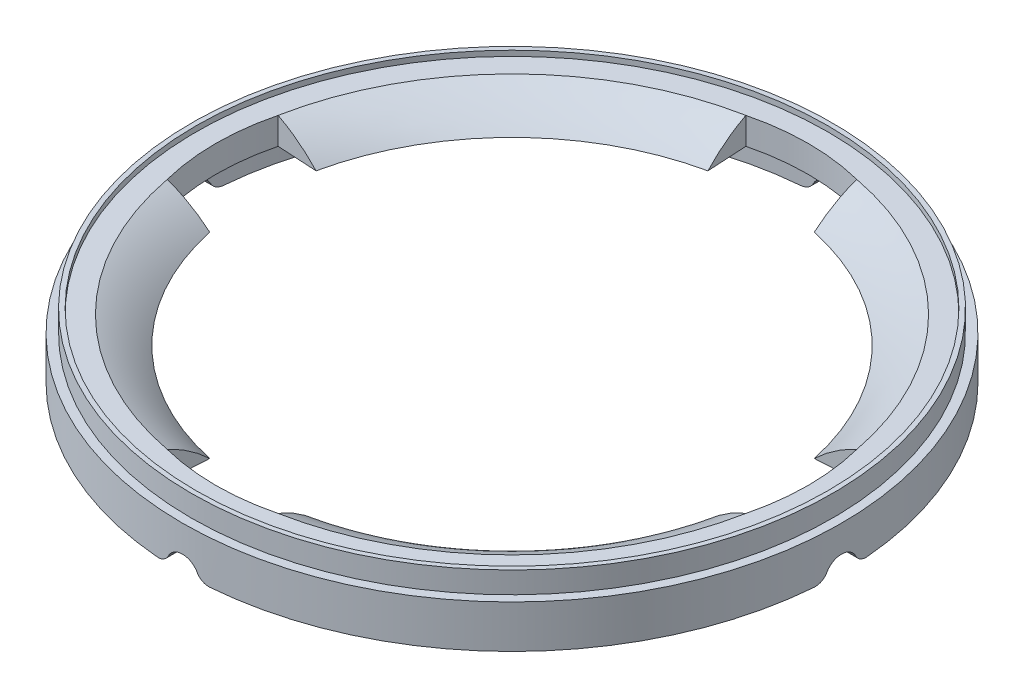
from build123d import *

# Parameters (mm, degrees)
SKETCH3_R                = 61.468
SKETCH3_R_2              = 58.95025584
BOSS_EXTRUDE1_DEPTH      = 8
SKETCH7_R                = 59.82025584
SKETCH7_R_2              = 58.95025584
BOSS_EXTRUDE2_DEPTH      = 4
CUT_EXTRUDE1_DEPTH       = 88.753233832
FILLET1_R                = 2.54
CIRPATTERN1_COUNT        = 4
FILLET1_OF_CIRPATTERN1_R = 2.54
CUT_EXTRUDE4_DEPTH       = 88.753233984
CIRPATTERN3_COUNT        = 4


with BuildPart() as part:
    # Sketch3 → Boss-Extrude1 (new body)
    with BuildSketch(Plane(origin=(0, 0, 0), x_dir=(1, 0, 0), z_dir=(0, 1, 0))):
        with Locations(Location((0, 0, 0), (0, 0, 270))):
            Circle(SKETCH3_R)
        with Locations(Location((0, 0, 0), (0, 0, 270))):
            Circle(SKETCH3_R_2, mode=Mode.SUBTRACT)
    extrude(amount=BOSS_EXTRUDE1_DEPTH)

    # Sketch7 → Boss-Extrude2 (add)
    with BuildSketch(Plane(origin=(0, 8, 0), x_dir=(1, 0, 0), z_dir=(0, 1, 0))):
        with Locations(Location((0, 0, 0), (0, 0, 270))):
            Circle(SKETCH7_R)
        with Locations(Location((0, 0, 0), (0, 0, 270))):
            Circle(SKETCH7_R_2, mode=Mode.SUBTRACT)
    extrude(amount=BOSS_EXTRUDE2_DEPTH)

    # Sketch9 → Cut-Extrude1 (cut, through all)
    with BuildSketch(Plane.XY):
        with BuildLine():
            Line((0, 0), (3, 0))
            ThreePointArc((3, 0), (0, 3), (-3, 0))
            Line((-3, 0), (0, 0))
        make_face()
    cut_extrude1 = extrude(amount=CUT_EXTRUDE1_DEPTH, mode=Mode.SUBTRACT)

    # Fillet1
    fillet1_edges = [part.edges().sort_by_distance(p)[0] for p in [
        (3, 0, 60.134309167),
        (-3, 0, 60.134309167),
    ]]
    fillet(fillet1_edges, radius=FILLET1_R)

    # CirPattern1: Cut-Extrude1 ×4 about axis
    cirpattern1_axis = Axis((0, 8, 0), (0, 1, 0))
    for i in range(1, CIRPATTERN1_COUNT):
        add(cut_extrude1.rotate(cirpattern1_axis, i * 360 / CIRPATTERN1_COUNT), mode=Mode.SUBTRACT)

    # Fillet1 of CirPattern1
    fillet1_of_cirpattern1_edges = [part.edges().sort_by_distance(p)[0] for p in [
        (60.134309167, 0, -3),
        (60.134309167, 0, 3),
        (-3, 0, -60.134309167),
        (3, 0, -60.134309167),
        (-60.134309167, 0, 3),
        (-60.134309167, 0, -3),
    ]]
    fillet(fillet1_of_cirpattern1_edges, radius=FILLET1_OF_CIRPATTERN1_R)

    # Sketch10 → Revolve2 (revolve)
    with BuildSketch(Plane.XY, mode=Mode.PRIVATE) as revolve2_sk:
        with BuildLine():
            Line((-58.95025584, 6), (-47.51025584, 6))
            ThreePointArc((-47.51025584, 6), (-51.004325155, 8.83618486), (-54.95025584, 11))
            Line((-54.95025584, 11), (-58.95025584, 11))
            Line((-58.95025584, 11), (-58.95025584, 6))
        make_face()
    revolve(revolve2_sk.sketch.rotate(Axis((0, 0, 0), (0, 1, 0)), 270), axis=Axis((0, 0, 0), (0, 1, 0)))

    # Sketch13 → Cut-Extrude4 (cut, through all)
    with BuildSketch(Plane(origin=(0, 0, 0), x_dir=(1, 0, 0), z_dir=(0, 1, 0))):
        with BuildLine():
            ThreePointArc((-9.707144427, 42.796913747), (-4.982712156, 44.461503222), (0, 44.97501853))
            Line((0, 44.97501853), (0, 55.25649697))
            ThreePointArc((0, 55.25649697), (-5.209883661, 54.933301733), (-10.339877075, 53.968672014))
            Line((-10.339877075, 53.968672014), (-9.707144427, 42.796913747))
        make_face()
        with BuildLine():
            Line((0, 55.25649697), (0, 44.97501853))
            ThreePointArc((0, 44.97501853), (4.993665079, 44.301497693), (9.688751248, 42.472157075))
            Line((9.688751248, 42.472157075), (10.339877075, 53.968672014))
            ThreePointArc((10.339877075, 53.968672014), (5.209883661, 54.933301733), (0, 55.25649697))
        make_face()
    cut_extrude4 = extrude(amount=CUT_EXTRUDE4_DEPTH, mode=Mode.SUBTRACT)

    # CirPattern3: Cut-Extrude4 ×4 about axis
    cirpattern3_axis = Axis((0, 0, 0), (0, 1, 0))
    for i in range(1, CIRPATTERN3_COUNT):
        add(cut_extrude4.rotate(cirpattern3_axis, i * 360 / CIRPATTERN3_COUNT), mode=Mode.SUBTRACT)


solid = part.part
